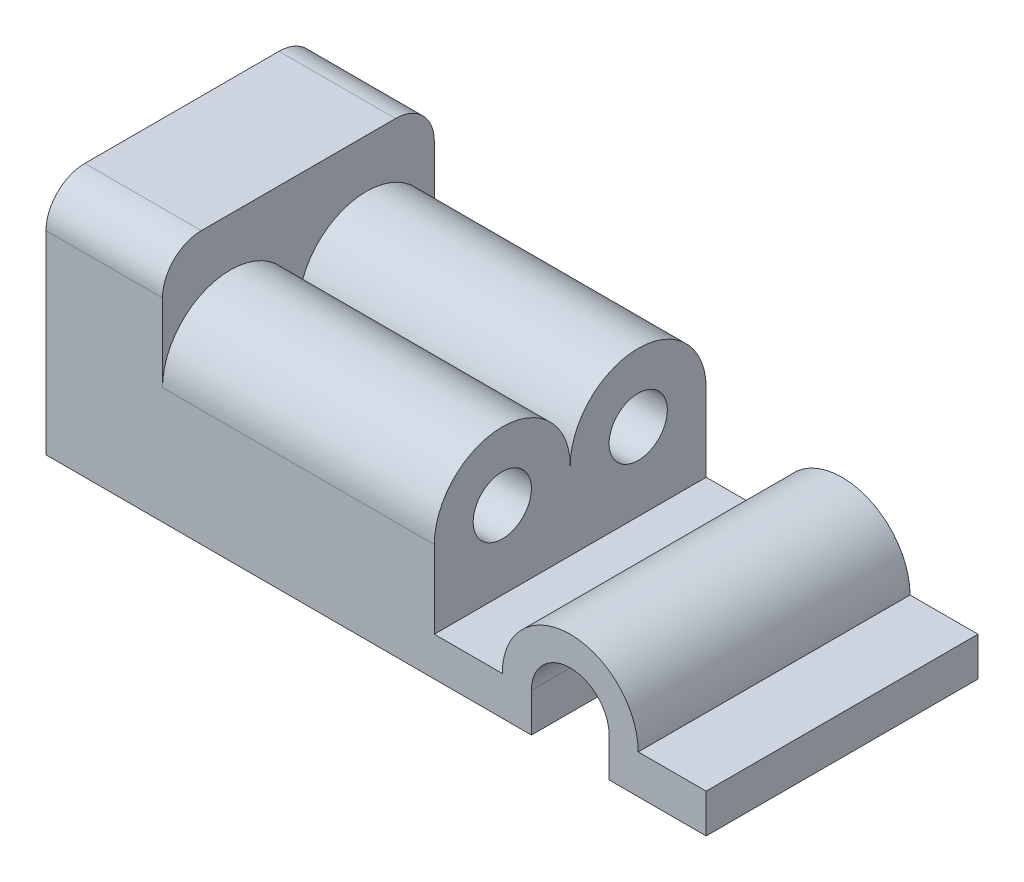
from build123d import *

# Parameters (mm, degrees)
BOSS_EXTRUDE1_DEPTH = 70
FILLET1_R           = 10
FILLET2_R           = 10
BOSS_EXTRUDE2_DEPTH = 70
SKETCH3_R           = 7.5
CUT_EXTRUDE1_DEPTH  = 185


with BuildPart() as part:
    # Sketch1 → Boss-Extrude1 (new body)
    with BuildSketch(Plane.XY):
        with BuildLine():
            Line((67.5, -20), (85, -20))
            Line((85, -20), (85, -30))
            Line((85, -30), (60, -30))
            Line((60, -30), (60, -20))
            ThreePointArc((60, -20), (50, -10), (40, -20))
            Line((40, -20), (40, -30))
            Line((40, -30), (-85, -30))
            Line((-85, -30), (-85, 30))
            Line((-85, 30), (-55, 30))
            Line((-55, 30), (-55, 0))
            Line((-55, 0), (15, 0))
            Line((15, 0), (15, -20))
            Line((15, -20), (32.5, -20))
            ThreePointArc((32.5, -20), (50, -2.5), (67.5, -20))
        make_face()
    extrude(amount=-BOSS_EXTRUDE1_DEPTH)

    # Fillet1
    fillet1_edges = [part.edges().sort_by_distance(p)[0] for p in [
        (-70, 30, 0),
    ]]
    fillet(fillet1_edges, radius=FILLET1_R)

    # Fillet2
    fillet2_edges = [part.edges().sort_by_distance(p)[0] for p in [
        (-70, 30, -70),
    ]]
    fillet(fillet2_edges, radius=FILLET2_R)

    # Sketch2 → Boss-Extrude2 (add)
    with BuildSketch(Plane(origin=(15, 0, 0), x_dir=(0, 0, -1), z_dir=(1, 0, 0))):
        with BuildLine():
            ThreePointArc((35, 0), (17.5, 17.5), (0, 0))
            Line((0, 0), (35, 0))
        make_face()
        with BuildLine():
            ThreePointArc((70, 0), (52.5, 17.5), (35, 0))
            Line((35, 0), (70, 0))
        make_face()
    extrude(amount=-BOSS_EXTRUDE2_DEPTH)

    # Sketch3 → Cut-Extrude1 (cut)
    with BuildSketch(Plane(origin=(15, 0, 0), x_dir=(0, 0, -1), z_dir=(1, 0, 0))):
        with Locations(Location((17.5, 0, 0), (0, 0, 90))):
            Circle(SKETCH3_R)
        with Locations(Location((52.5, 0, 0), (0, 0, 90))):
            Circle(SKETCH3_R)
    extrude(amount=-CUT_EXTRUDE1_DEPTH, mode=Mode.SUBTRACT)


solid = part.part
